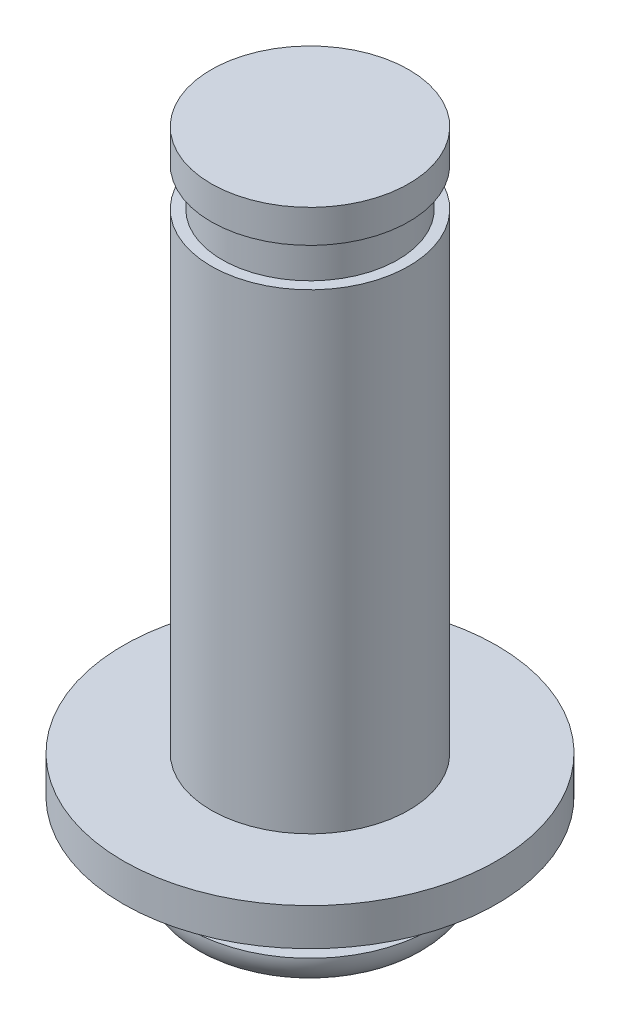
from build123d import *


with BuildPart() as part:
    # Esboço1 → Revolução1 (revolve)
    with BuildSketch(Plane(origin=(0, 0, 0), x_dir=(0, 0, -1), z_dir=(1, 0, 0)), mode=Mode.PRIVATE) as revolu_o1_sk:
        with BuildLine():
            Line((0, 30.4), (0, 0))
            Line((0, 0), (-4, 0))
            ThreePointArc((-4, 0), (-5.060660172, 0.439339828), (-5.5, 1.5))
            Line((-5.5, 1.5), (-4.5, 1.5))
            Line((-4.5, 1.5), (-4.5, 4))
            Line((-4.5, 4), (-8.5, 4))
            Line((-8.5, 4), (-8.5, 5.7))
            Line((-8.5, 5.7), (-4.5, 5.7))
            Line((-4.5, 5.7), (-4.5, 27.15))
            Line((-4.5, 27.15), (-4, 27.15))
            Line((-4, 27.15), (-4, 28.9))
            Line((-4, 28.9), (-4.5, 28.9))
            Line((-4.5, 28.9), (-4.5, 30.4))
            Line((-4.5, 30.4), (0, 30.4))
        make_face()
    revolve(revolu_o1_sk.sketch.rotate(Axis((0, 0, 0), (0, 1, 0)), 180), axis=Axis((0, 0, 0), (0, 1, 0)))


solid = part.part
